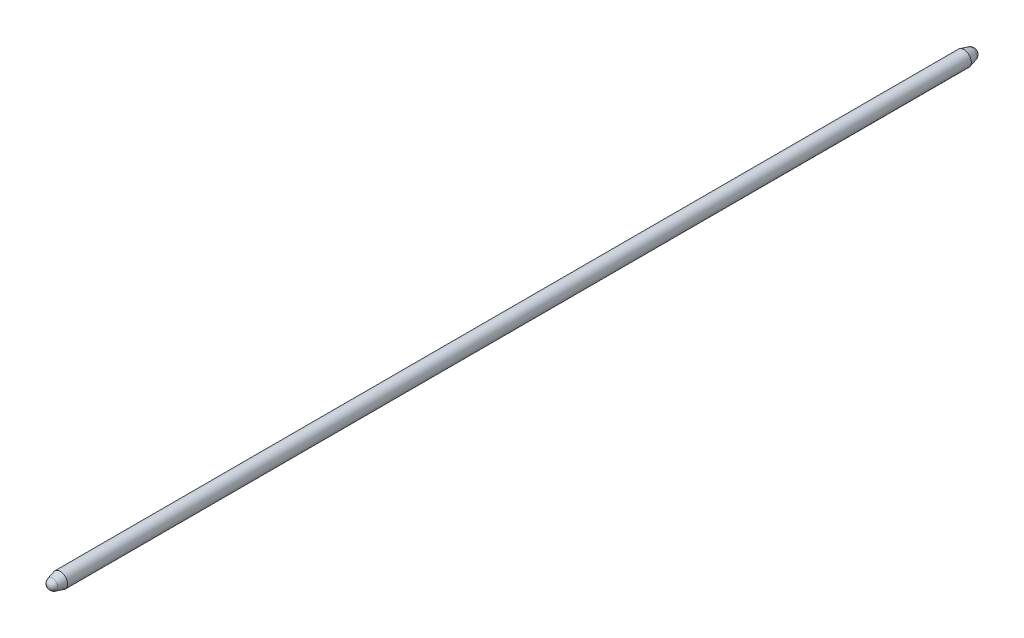
from build123d import *


with BuildPart() as part:
    # Sketch2 → Revolve1 (revolve)
    with BuildSketch(Plane(origin=(0, 0, 0), x_dir=(0, 0, -1), z_dir=(1, 0, 0))):
        with BuildLine():
            Line((1537.721359991, 25.4), (1563.842405349, 18.400886991))
            ThreePointArc((1563.842405349, 18.400886991), (1574.025283673, 11.596905223), (1577.96190254, 0))
            Line((1577.96190254, 0), (1537.721359991, 0))
            Line((1537.721359991, 0), (1537.721359991, 22.987))
            Line((1537.721359991, 22.987), (-1537.721359991, 22.987))
            Line((-1537.721359991, 22.987), (-1537.721359991, 0))
            Line((-1537.721359991, 0), (-1577.96190254, 0))
            ThreePointArc((-1577.96190254, 0), (-1574.025283673, 11.596905223), (-1563.842405349, 18.400886991))
            Line((-1563.842405349, 18.400886991), (-1537.721359991, 25.4))
            Line((-1537.721359991, 25.4), (1537.721359991, 25.4))
        make_face()
    revolve(axis=Axis((0, 0, -1577.96190254), (0, 0, 1)))


solid = part.part
